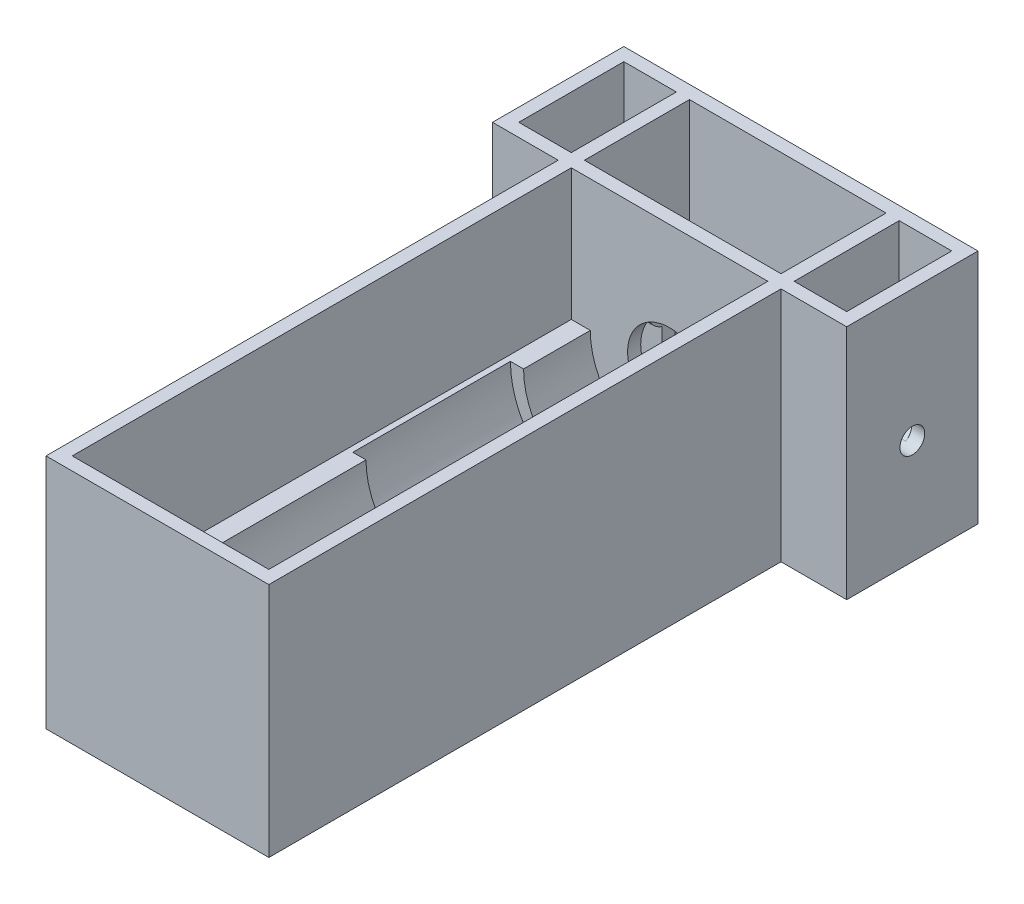
from build123d import *

# Parameters (mm, degrees)
BOSS_EXTRUDE1_DEPTH      = 12.7
SKETCH2_W                = 53.879496
SKETCH2_H                = 57.15
BOSS_EXTRUDE2_DEPTH      = 3.175
CUT_EXTRUDE2_DEPTH       = 66.145131417
CUT_EXTRUDE2_DEPTH_BACK  = 66.145131417
SKETCH3_R                = 3
SKETCH5_W                = 53.879496
SKETCH5_H                = 25.4
SKETCH5_R                = 3.4925
BOSS_EXTRUDE3_DEPTH      = 6.35
SKETCH7_W                = 7.62
SKETCH7_H                = 15.609396712
BOSS_EXTRUDE7_DEPTH      = 1.5875
SKETCH8_W                = 53.879496
SKETCH8_H                = 57.15
BOSS_EXTRUDE8_DEPTH      = 127
CUT_EXTRUDE7_DEPTH       = 154.323065852
CUT_EXTRUDE7_DEPTH_BACK  = 154.323065852
SKETCH13_W               = 0.002356984
SKETCH13_H               = 124.229061331
CUT_EXTRUDE8_START       = -31.75
SKETCH14_W               = 47.527139016
SKETCH14_H               = 120.65
CUT_EXTRUDE8_DEPTH       = 31.75
CUT_EXTRUDE9_DEPTH       = 4.229066359
SKETCH16_W               = 53.879496
SKETCH16_H               = 25.4
CUT_EXTRUDE10_DEPTH      = 152.071109158
SKETCH18_W               = 19.05
SKETCH18_H               = 31.75
SKETCH18_W_2             = 12.7
SKETCH18_H_2             = 25.4
BOSS_EXTRUDE10_DEPTH     = 57.15
BOSS_EXTRUDE11_START     = -39.639748
BOSS_EXTRUDE11_DEPTH     = 12.7
BOSS_EXTRUDE12_START     = 26.939748
BOSS_EXTRUDE12_DEPTH     = 12.7
CUT_EXTRUDE11_DEPTH      = 165.969820839
CUT_EXTRUDE11_DEPTH_BACK = 165.969820839
SKETCH20_R               = 3


with BuildPart() as part:
    # Sketch1 → Boss-Extrude1 (new, symmetric)
    with BuildSketch(Plane.XY):
        Polygon((-26.939748, 0), (26.939748, 0), (26.939748, 6.35), (26.939748, 57.15), (23.764748, 57.15), (23.764748, 6.35), (-23.764748, 6.35), (-23.764748, 57.15), (-26.939748, 57.15), (-26.939748, 6.35), align=None)
    extrude(amount=BOSS_EXTRUDE1_DEPTH, both=True)

    # Sketch2 → Boss-Extrude2 (add)
    with BuildSketch(Plane(origin=(0, 0, -12.7), x_dir=(-1, 0, 0), z_dir=(0, 0, -1))):
        with Locations((0, 28.575)):
            Rectangle(SKETCH2_W, SKETCH2_H)
    extrude(amount=BOSS_EXTRUDE2_DEPTH)

    # Sketch6 → Revolve2 (revolve)
    with BuildSketch(Plane.XY, mode=Mode.PRIVATE) as revolve2_sk:
        Polygon((-23.764748, 25.4), (-16.144748, 25.4), (-16.144748, 30.48), (-21.224748, 30.48), (-23.764748, 33.02), align=None)
        Polygon((23.764748, 33.02), (23.764748, 25.4), (16.144748, 25.4), (16.144748, 30.48), (21.224748, 30.48), align=None)
    revolve(revolve2_sk.sketch.rotate(Axis((-23.764748, 25.4, 0), (1, 0, 0)), 90), axis=Axis((-23.764748, 25.4, 0), (1, 0, 0)))

    # Sketch3 → Cut-Extrude2 (cut, two sides: drawn at the far end of the back side and taken through both)
    with BuildSketch(Plane(origin=(0, 0, 0), x_dir=(0, 0, -1), z_dir=(1, 0, 0)).offset(-CUT_EXTRUDE2_DEPTH_BACK)):
        with Locations((0, 25.4)):
            Circle(SKETCH3_R)
    extrude(amount=CUT_EXTRUDE2_DEPTH + CUT_EXTRUDE2_DEPTH_BACK, mode=Mode.SUBTRACT)

    # Sketch5 → Boss-Extrude3 (add)
    with BuildSketch(Plane.XZ):
        with Locations((0, -28.575)):
            Rectangle(SKETCH5_W, SKETCH5_H)
        with Locations(Location((7.889748, -28.575, 0), (0, 0, 270))):
            Circle(SKETCH5_R, mode=Mode.SUBTRACT)
        with Locations(Location((-17.510252, -28.575, 0), (0, 0, 270))):
            Circle(SKETCH5_R, mode=Mode.SUBTRACT)
    extrude(amount=-BOSS_EXTRUDE3_DEPTH)

    # Sketch7 → Boss-Extrude7 (add, symmetric)
    with BuildSketch(Plane.XY):
        with Locations((-19.954748, 14.154698356)):
            Rectangle(SKETCH7_W, SKETCH7_H)
        with Locations((19.954748, 14.154698356)):
            Rectangle(SKETCH7_W, SKETCH7_H)
    extrude(amount=BOSS_EXTRUDE7_DEPTH, both=True)

    # Sketch8 → Boss-Extrude8 (add)
    with BuildSketch(Plane.XY.offset(12.7)):
        with Locations((0, 28.575)):
            Rectangle(SKETCH8_W, SKETCH8_H)
    extrude(amount=BOSS_EXTRUDE8_DEPTH)

    # Sketch9 → Cut-Revolve1 (revolve, cut)
    with BuildSketch(Plane(origin=(0, 0, 0), x_dir=(0, 0, -1), z_dir=(1, 0, 0))):
        Polygon((-70.104, 47.752), (-70.104, 44.577), (-136.525, 44.577), (-136.525, 25.4), (-70.104, 25.4), (0, 25.4), (0, 35.56), (-20.104066359, 35.56), (-20.104066359, 44.577), (-32.004, 44.577), (-32.004, 47.752), align=None)
    revolve(axis=Axis((0, 25.4, 0), (0, 0, 1)), mode=Mode.SUBTRACT)

    # Sketch13 → Cut-Extrude7 (cut, two sides: drawn at the far end of the back side and taken through both)
    with BuildSketch(Plane(origin=(0, 0, 0), x_dir=(-1, 0, 0), z_dir=(0, -1, 0)).offset(-CUT_EXTRUDE7_DEPTH_BACK)):
        with Locations((26.940926492, -77.585469335)):
            Rectangle(SKETCH13_W, SKETCH13_H)
        with Locations((-26.938569508, -77.585469335)):
            Rectangle(SKETCH13_W, SKETCH13_H)
    extrude(amount=CUT_EXTRUDE7_DEPTH + CUT_EXTRUDE7_DEPTH_BACK, mode=Mode.SUBTRACT)

    # Sketch14 → Cut-Extrude8 (cut)
    with BuildSketch(Plane(origin=(0, 57.15, 0), x_dir=(1, 0, 0), z_dir=(0, 1, 0)).offset(CUT_EXTRUDE8_START)):
        with Locations((-0.001178492, -76.2)):
            Rectangle(SKETCH14_W, SKETCH14_H)
    extrude(amount=CUT_EXTRUDE8_DEPTH, mode=Mode.SUBTRACT)

    # Sketch15 → Cut-Extrude9 (cut)
    with BuildSketch(Plane.XY.offset(20.104066359)):
        with BuildLine():
            Line((-10.16, 25.4), (-19.177, 25.4))
            ThreePointArc((-19.177, 25.4), (0, 6.223), (19.177, 25.4))
            Line((19.177, 25.4), (10.16, 25.4))
            ThreePointArc((10.16, 25.4), (0, 15.24), (-10.16, 25.4))
        make_face()
    extrude(amount=-CUT_EXTRUDE9_DEPTH, mode=Mode.SUBTRACT)

    # Sketch16 → Cut-Extrude10 (cut, through all)
    with BuildSketch(Plane(origin=(0, 6.35, 0), x_dir=(1, 0, 0), z_dir=(0, 1, 0))):
        with Locations((0, 28.575)):
            Rectangle(SKETCH16_W, SKETCH16_H)
    extrude(amount=-CUT_EXTRUDE10_DEPTH, mode=Mode.SUBTRACT)

    # Sketch18 → Boss-Extrude10 (add)
    with BuildSketch(Plane(origin=(0, 0, 0), x_dir=(1, 0, 0), z_dir=(0, 1, 0))):
        with Locations((-33.289748, 0)):
            Rectangle(SKETCH18_W, SKETCH18_H)
        with Locations((-33.289748, 0)):
            Rectangle(SKETCH18_W_2, SKETCH18_H_2, mode=Mode.SUBTRACT)
    boss_extrude10 = extrude(amount=BOSS_EXTRUDE10_DEPTH)

    # Sketch19 → Boss-Extrude11 (add)
    with BuildSketch(Plane(origin=(0, 0, 0), x_dir=(0, 0, -1), z_dir=(1, 0, 0)).offset(BOSS_EXTRUDE11_START)):
        with BuildLine():
            Line((1.5875, 22.854446278), (12.7, 29.784605952))
            Line((12.7, 29.784605952), (12.7, 0))
            Line((12.7, 0), (-12.7, 0))
            Line((-12.7, 0), (-12.7, 29.784605952))
            Line((-12.7, 29.784605952), (-1.5875, 22.854446278))
            ThreePointArc((-1.5875, 22.854446278), (0, 22.4), (1.5875, 22.854446278))
        make_face()
    extrude(amount=BOSS_EXTRUDE11_DEPTH)

    # Mirror4: Boss-Extrude10 across plane
    add(boss_extrude10.mirror(Plane(origin=(0, 0, 0), x_dir=(0, 0, 1), z_dir=(1, 0, 0))))

    # Sketch19<2> → Boss-Extrude12 (add)
    with BuildSketch(Plane(origin=(0, 0, 0), x_dir=(0, 0, -1), z_dir=(1, 0, 0)).offset(BOSS_EXTRUDE12_START)):
        with BuildLine():
            Line((1.5875, 22.854446278), (12.7, 29.784605952))
            Line((12.7, 29.784605952), (12.7, 0))
            Line((12.7, 0), (-12.7, 0))
            Line((-12.7, 0), (-12.7, 29.784605952))
            Line((-12.7, 29.784605952), (-1.5875, 22.854446278))
            ThreePointArc((-1.5875, 22.854446278), (0, 22.4), (1.5875, 22.854446278))
        make_face()
    extrude(amount=BOSS_EXTRUDE12_DEPTH)

    # Sketch20 → Cut-Extrude11 (cut, two sides: drawn at the far end of the back side and taken through both)
    with BuildSketch(Plane(origin=(-23.764748, 0, 0), x_dir=(0, 0, -1), z_dir=(1, 0, 0)).offset(-CUT_EXTRUDE11_DEPTH_BACK)):
        with Locations((0, 25.4)):
            Circle(SKETCH20_R)
    extrude(amount=CUT_EXTRUDE11_DEPTH + CUT_EXTRUDE11_DEPTH_BACK, mode=Mode.SUBTRACT)


solid = part.part
